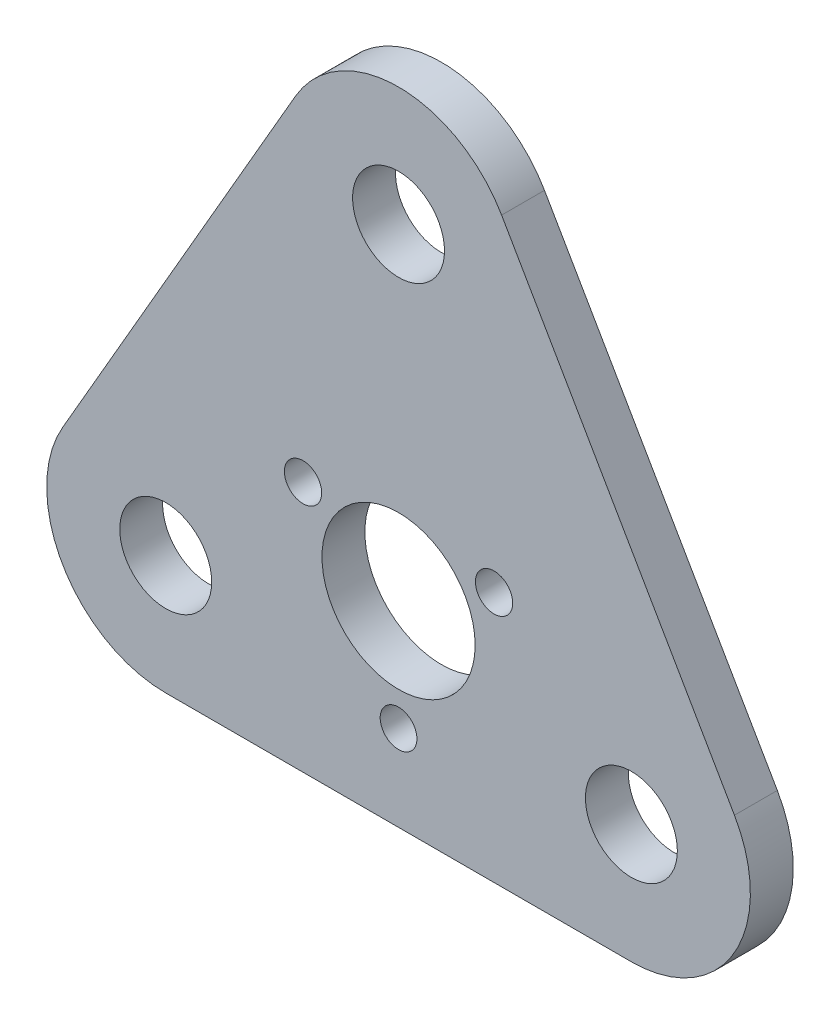
from build123d import *

# Parameters (mm, degrees)
SKETCH1_R           = 7.5
SKETCH1_R_2         = 12.5
SKETCH1_R_3         = 3
SKETCH1_R_4         = 3.042653236
BOSS_EXTRUDE1_DEPTH = 7


with BuildPart() as part:
    # Sketch1 → Boss-Extrude1 (new body)
    with BuildSketch(Plane.XY):
        with BuildLine():
            Line((-16.819672131, 55.195439587), (-54.819672131, -10.622491101))
            ThreePointArc((-54.819672131, -10.622491101), (-54.819672131, -30.044175566), (-38, -39.755017799))
            Line((-38, -39.755017799), (38, -39.755017799))
            ThreePointArc((38, -39.755017799), (54.819672131, -30.044175566), (54.819672131, -10.622491101))
            Line((54.819672131, -10.622491101), (16.819672131, 55.195439587))
            ThreePointArc((16.819672131, 55.195439587), (0, 64.906281819), (-16.819672131, 55.195439587))
        make_face()
        with Locations((0, 45.484597354)):
            Circle(SKETCH1_R, mode=Mode.SUBTRACT)
        with Locations((38, -20.333333333)):
            Circle(SKETCH1_R, mode=Mode.SUBTRACT)
        with Locations((-38, -20.333333333)):
            Circle(SKETCH1_R, mode=Mode.SUBTRACT)
        with Locations((0, -7.755017799)):
            Circle(SKETCH1_R_2, mode=Mode.SUBTRACT)
        with Locations((0, -25.755017799)):
            Circle(SKETCH1_R_3, mode=Mode.SUBTRACT)
        with Locations((-15.588457268, 1.244982201)):
            Circle(SKETCH1_R_4, mode=Mode.SUBTRACT)
        with Locations(Location((15.588457268, 1.244982201, 0), (0, 0, 180))):
            Circle(SKETCH1_R_4, mode=Mode.SUBTRACT)
    extrude(amount=BOSS_EXTRUDE1_DEPTH)


solid = part.part
